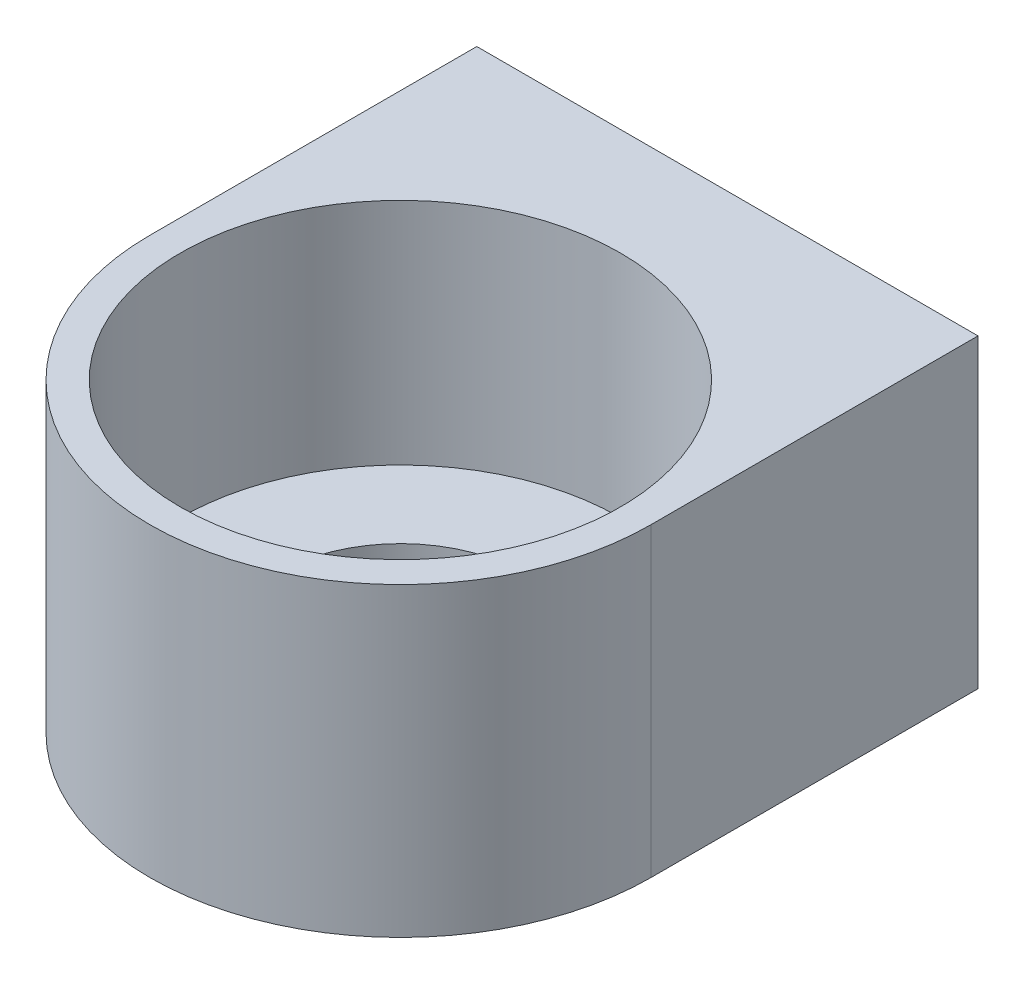
from build123d import *

# Parameters (mm, degrees)
SKETCH1_R           = 8.1
BOSS_EXTRUDE1_DEPTH = 100
SKETCH2_R           = 14.4
CUT_EXTRUDE1_DEPTH  = 80
CUT_EXTRUDE2_START  = -80
CUT_EXTRUDE2_DEPTH  = 80
SKETCH4_R           = 14.4
CUT_EXTRUDE3_DEPTH  = 15
SKETCH8_W           = 32.8
SKETCH8_H           = 80
CUT_EXTRUDE4_DEPTH  = 106.913171985
CUT_EXTRUDE5_START  = -2
SKETCH9_R           = 4.1
CUT_EXTRUDE5_DEPTH  = 3.1


with BuildPart() as part:
    # Sketch1 → Boss-Extrude1 (new body)
    with BuildSketch(Plane(origin=(0, 0, 0), x_dir=(1, 0, 0), z_dir=(0, 1, 0))):
        with BuildLine():
            Line((-16.4, 0), (-16.4, 21.4))
            Line((-16.4, 21.4), (16.4, 21.4))
            Line((16.4, 21.4), (16.4, 0))
            ThreePointArc((16.4, 0), (0, -16.4), (-16.4, 0))
        make_face()
        with Locations(Location((0, 0, 0), (0, 0, 270))):
            Circle(SKETCH1_R, mode=Mode.SUBTRACT)
    extrude(amount=BOSS_EXTRUDE1_DEPTH)

    # Sketch2 → Cut-Extrude1 (cut)
    with BuildSketch(Plane(origin=(0, 100, 0), x_dir=(1, 0, 0), z_dir=(0, 1, 0))):
        with Locations(Location((0, 0, 0), (0, 0, 270))):
            Circle(SKETCH2_R)
    extrude(amount=-CUT_EXTRUDE1_DEPTH, mode=Mode.SUBTRACT)

    # Sketch3 → Cut-Extrude2 (cut)
    with BuildSketch(Plane(origin=(0, 100, 0), x_dir=(1, 0, 0), z_dir=(0, 1, 0)).offset(CUT_EXTRUDE2_START)):
        with BuildLine():
            Line((-16.4, 0), (-16.4, 14.4))
            Line((-16.4, 14.4), (16.4, 14.4))
            Line((16.4, 14.4), (16.4, 0))
            ThreePointArc((16.4, 0), (0, -16.4), (-16.4, 0))
        make_face()
    extrude(amount=CUT_EXTRUDE2_DEPTH, mode=Mode.SUBTRACT)

    # Sketch4 → Cut-Extrude3 (cut)
    with BuildSketch(Plane(origin=(0, 20, 0), x_dir=(1, 0, 0), z_dir=(0, 1, 0))):
        with Locations(Location((0, 0, 0), (0, 0, 270))):
            Circle(SKETCH4_R)
    extrude(amount=-CUT_EXTRUDE3_DEPTH, mode=Mode.SUBTRACT)

    # Sketch8 → Cut-Extrude4 (cut, through all)
    with BuildSketch(Plane.XY.offset(-14.4)):
        with Locations((0, 60)):
            Rectangle(SKETCH8_W, SKETCH8_H)
    extrude(amount=-CUT_EXTRUDE4_DEPTH, mode=Mode.SUBTRACT)

    # Sketch9 → Cut-Extrude5 (cut)
    with BuildSketch(Plane(origin=(0, 20, 0), x_dir=(1, 0, 0), z_dir=(0, 1, 0)).offset(CUT_EXTRUDE5_START)):
        with Locations(Location((-11.366921431, 16.176228268, 0), (0, 0, 270))):
            Circle(SKETCH9_R)
    cut_extrude5 = extrude(amount=-CUT_EXTRUDE5_DEPTH, mode=Mode.SUBTRACT)

    # Mirror1: Cut-Extrude5 across plane
    add(cut_extrude5.mirror(Plane(origin=(0, 0, 0), x_dir=(0, 0, 1), z_dir=(1, 0, 0))), mode=Mode.SUBTRACT)


solid = part.part
